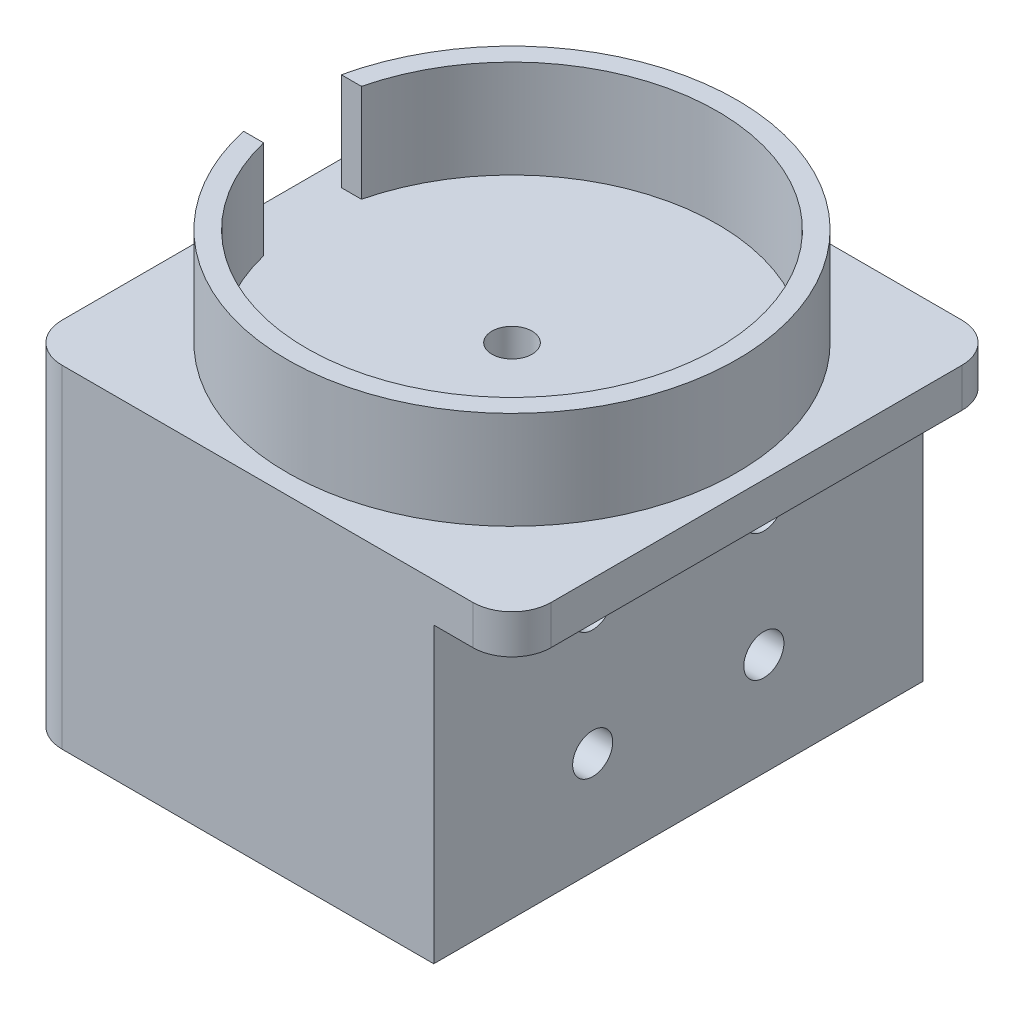
from build123d import *

# Parameters (mm, degrees)
BOSS_EXTRUDE1_DEPTH   = 30
CUT_EXTRUDE1_START    = -7.5
SKETCH3_W             = 34
SKETCH3_H             = 26
CUT_EXTRUDE1_DEPTH    = 35
F_4_0MM_DOWEL_HOLE2_D = 4.1
F_4_0MM_DOWEL_HOLE1_D = 4.1
BOSS_EXTRUDE2_DEPTH   = 4
BOSS_EXTRUDE3_DEPTH   = 10
F_4_0MM_DOWEL_HOLE3_D = 4.1


with BuildPart() as part:
    # Sketch1 → Boss-Extrude1 (new body)
    with BuildSketch(Plane(origin=(0, 0, 0), x_dir=(1, 0, 0), z_dir=(0, 1, 0))):
        with BuildLine():
            Line((42, 0), (42, 50))
            Line((42, 50), (4, 50))
            ThreePointArc((4, 50), (1.171572875, 48.828427125), (0, 46))
            Line((0, 46), (0, 4))
            ThreePointArc((0, 4), (1.171572875, 1.171572875), (4, 0))
            Line((4, 0), (42, 0))
        make_face()
    extrude(amount=BOSS_EXTRUDE1_DEPTH)

    # Sketch3 → Cut-Extrude1 (cut)
    with BuildSketch(Plane.XY.offset(CUT_EXTRUDE1_START)):
        with Locations((17, 17)):
            Rectangle(SKETCH3_W, SKETCH3_H)
    extrude(amount=-CUT_EXTRUDE1_DEPTH, mode=Mode.SUBTRACT)

    # Ø4.0mm Dowel Hole2 (through all)
    with Locations(Plane(origin=(25, 4, -35), x_dir=(1, 0, 0), z_dir=(0, 1, 0))):
        with Locations((0, 0), (0, -10), (0, -20), (-10, -10)):
            Hole(F_4_0MM_DOWEL_HOLE2_D / 2)

    # Ø4.0mm Dowel Hole1 (through all)
    with Locations(Plane(origin=(42, 23.5, -16.25), x_dir=(0, 0, 1), z_dir=(1, 0, 0))):
        with Locations((0, 0), (-17.5, 0), (-17.5, 13), (0, 13)):
            Hole(F_4_0MM_DOWEL_HOLE1_D / 2)

    # Sketch5 → Boss-Extrude2 (add)
    with BuildSketch(Plane(origin=(0, 30, 0), x_dir=(1, 0, 0), z_dir=(0, 1, 0))):
        with BuildLine():
            Line((4, 0), (46, 0))
            ThreePointArc((46, 0), (48.828427125, 1.171572875), (50, 4))
            Line((50, 4), (50, 46))
            ThreePointArc((50, 46), (48.828427125, 48.828427125), (46, 50))
            Line((46, 50), (4, 50))
            ThreePointArc((4, 50), (1.171572875, 48.828427125), (0, 46))
            Line((0, 46), (0, 4))
            ThreePointArc((0, 4), (1.171572875, 1.171572875), (4, 0))
        make_face()
    extrude(amount=BOSS_EXTRUDE2_DEPTH)

    # Sketch8 → Boss-Extrude3 (add)
    with BuildSketch(Plane(origin=(0, 34, 0), x_dir=(1, 0, 0), z_dir=(0, 1, 0))):
        with BuildLine():
            ThreePointArc((48, 25), (27.515082566, 47.862072515), (2.550055679, 30))
            Line((2.550055679, 30), (4.603921946, 30))
            ThreePointArc((4.603921946, 30), (27.518170056, 45.848472835), (46, 25))
            ThreePointArc((46, 25), (27.518170056, 4.151527165), (4.603921946, 20))
            Line((4.603921946, 20), (2.550055679, 20))
            ThreePointArc((2.550055679, 20), (27.515082566, 2.137927485), (48, 25))
        make_face()
    extrude(amount=BOSS_EXTRUDE3_DEPTH)

    # Ø4.0mm Dowel Hole3 (through all)
    with Locations(Plane(origin=(25, 44, -25), x_dir=(0, 0, 1), z_dir=(0, 1, 0))):
        with Locations((0, 0)):
            Hole(F_4_0MM_DOWEL_HOLE3_D / 2)


solid = part.part
